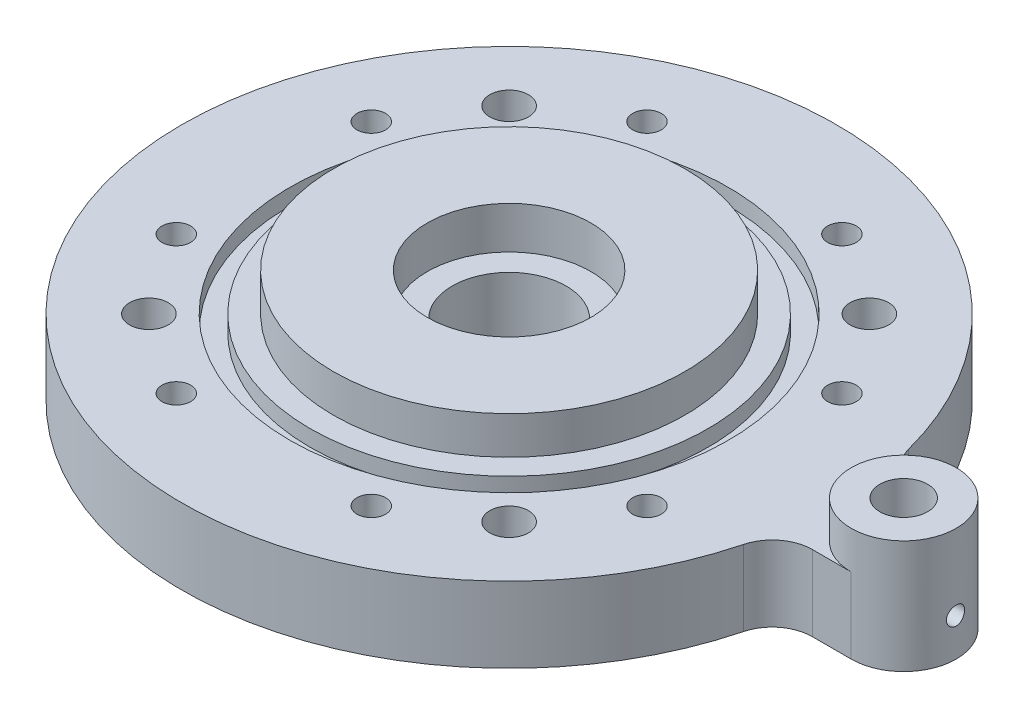
from build123d import *

# Parameters (mm, degrees)
BASE_DEPTH                       = 13.175
SKETCH3_R                        = 3.373437
SKETCH3_R_2                      = 3.373438
SQUARE_BOLT_HOLES_DEPTH          = 98.608945
SKETCH4_R                        = 2.5
HOUSING_BOLTS_DEPTH              = 44.33
CIRPATTERN1_COUNT                = 8
SKETCH2_R                        = 30.6705
SKETCH2_R_2                      = 9.167187
SKETCH2_R_3                      = 4.167187
IMPELLER_CAVITY_RISER_DEPTH      = 6.59
SKETCH5_R                        = 14.2875
SEAL_BORE_DEPTH                  = 7.35
SKETCH6_R                        = 9.9375
BORE_DEPTH                       = 39.3
PRESSURE_TAP_DEPTH               = 130.310741
PRESSURE_TAP_DEPTH_BACK          = 57.15
SKETCH9_R                        = 1.5875
SKETCH10_R                       = 1.5875
PRESSURE_TAP_VERTICAL_HOLE_DEPTH = 8.175
SKETCH12_R                       = 38.2524
SKETCH12_R_2                     = 34.7218
O_RING_FEATURE_DEPTH             = 2.82448


with BuildPart() as part:
    # Sketch1 → base (new body)
    with BuildSketch(Plane(origin=(0, 0, 0), x_dir=(1, 0, 0), z_dir=(0, 1, 0))):
        with BuildLine():
            Line((62.079341, 9.167187), (68.857187, 9.167187))
            ThreePointArc((68.857187, 9.167187), (78.024375, 0), (68.857187, -9.167187))
            Line((68.857187, -9.167187), (62.079341, -9.167187))
            ThreePointArc((62.079341, -9.167187), (57.798515, -10.628728), (55.30529, -14.403036))
            ThreePointArc((55.30529, -14.403036), (-57.15, 0), (55.30529, 14.403036))
            ThreePointArc((55.30529, 14.403036), (57.798515, 10.628728), (62.079341, 9.167187))
        make_face()
    extrude(amount=BASE_DEPTH)

    # Sketch3 → square bolt holes (cut, through all)
    with BuildSketch(Plane.XZ):
        with Locations(Location((-31.430896, -31.430896, 0), (0, 0, 270))):
            Circle(SKETCH3_R)
        with Locations(Location((-31.430896, 31.430896, 0), (0, 0, 270))):
            Circle(SKETCH3_R)
        with Locations(Location((31.430896, 31.430896, 0), (0, 0, 270))):
            Circle(SKETCH3_R_2)
        with Locations(Location((31.430896, -31.430896, 0), (0, 0, 270))):
            Circle(SKETCH3_R_2)
    extrude(amount=-SQUARE_BOLT_HOLES_DEPTH, mode=Mode.SUBTRACT)

    # Sketch4 → housing bolts (cut)
    with BuildSketch(Plane(origin=(0, 13.175, 0), x_dir=(1, 0, 0), z_dir=(0, 1, 0))):
        with Locations(Location((17.010279, 41.066445, 0), (0, 0, 270))):
            Circle(SKETCH4_R)
    housing_bolts = extrude(amount=-HOUSING_BOLTS_DEPTH, mode=Mode.SUBTRACT)

    # CirPattern1: housing bolts ×8 about axis
    cirpattern1_axis = Axis((0, 0, 0), (0, 1, 0))
    for i in range(1, CIRPATTERN1_COUNT):
        add(housing_bolts.rotate(cirpattern1_axis, i * 360 / CIRPATTERN1_COUNT), mode=Mode.SUBTRACT)

    # Sketch2 → impeller cavity riser (add)
    # profile 1 of 2: a face of its own
    with BuildSketch(Plane(origin=(0, 13.175, 0), x_dir=(1, 0, 0), z_dir=(0, 1, 0))):
        with Locations(Location((0, 0, 0), (0, 0, 270))):
            Circle(SKETCH2_R)
    # profile 2 of 2: a face of its own
    with BuildSketch(Plane(origin=(0, 13.175, 0), x_dir=(1, 0, 0), z_dir=(0, 1, 0))):
        with Locations(Location((68.857187, 0, 0), (0, 0, 270))):
            Circle(SKETCH2_R_2)
        with Locations(Location((68.857187, 0, 0), (0, 0, 270))):
            Circle(SKETCH2_R_3, mode=Mode.SUBTRACT)
    extrude(amount=IMPELLER_CAVITY_RISER_DEPTH)

    # Sketch5 → seal bore (cut)
    with BuildSketch(Plane(origin=(0, 19.765, 0), x_dir=(1, 0, 0), z_dir=(0, 1, 0))):
        with Locations(Location((0, 0, 0), (0, 0, 270))):
            Circle(SKETCH5_R)
    extrude(amount=-SEAL_BORE_DEPTH, mode=Mode.SUBTRACT)

    # Sketch6 → bore (cut)
    with BuildSketch(Plane(origin=(0, 12.415, 0), x_dir=(1, 0, 0), z_dir=(0, 1, 0))):
        with Locations(Location((0, 0, 0), (0, 0, 270))):
            Circle(SKETCH6_R)
    extrude(amount=-BORE_DEPTH, mode=Mode.SUBTRACT)

    # Sketch9 → pressure tap (cut, two sides: drawn at the far end of the back side and taken through both)
    with BuildSketch(Plane(origin=(57.15, 0, 0), x_dir=(0, 0, -1), z_dir=(1, 0, 0)).offset(-PRESSURE_TAP_DEPTH_BACK)):
        with Locations(Location((0, 6.5875, 0), (0, 0, 180))):
            Circle(SKETCH9_R)
    extrude(amount=PRESSURE_TAP_DEPTH + PRESSURE_TAP_DEPTH_BACK, mode=Mode.SUBTRACT)

    # Sketch10 → pressure tap vertical hole (cut)
    with BuildSketch(Plane(origin=(0, 13.175, 0), x_dir=(1, 0, 0), z_dir=(0, 1, 0))):
        with Locations(Location((68.857187, 0, 0), (0, 0, 270))):
            Circle(SKETCH10_R)
    extrude(amount=-PRESSURE_TAP_VERTICAL_HOLE_DEPTH, mode=Mode.SUBTRACT)

    # Sketch12 → o ring feature (cut)
    with BuildSketch(Plane(origin=(0, 13.175, 0), x_dir=(1, 0, 0), z_dir=(0, 1, 0))):
        with Locations(Location((0, 0, 0), (0, 0, 270))):
            Circle(SKETCH12_R)
        with Locations(Location((0, 0, 0), (0, 0, 270))):
            Circle(SKETCH12_R_2, mode=Mode.SUBTRACT)
    extrude(amount=-O_RING_FEATURE_DEPTH, mode=Mode.SUBTRACT)


solid = part.part
